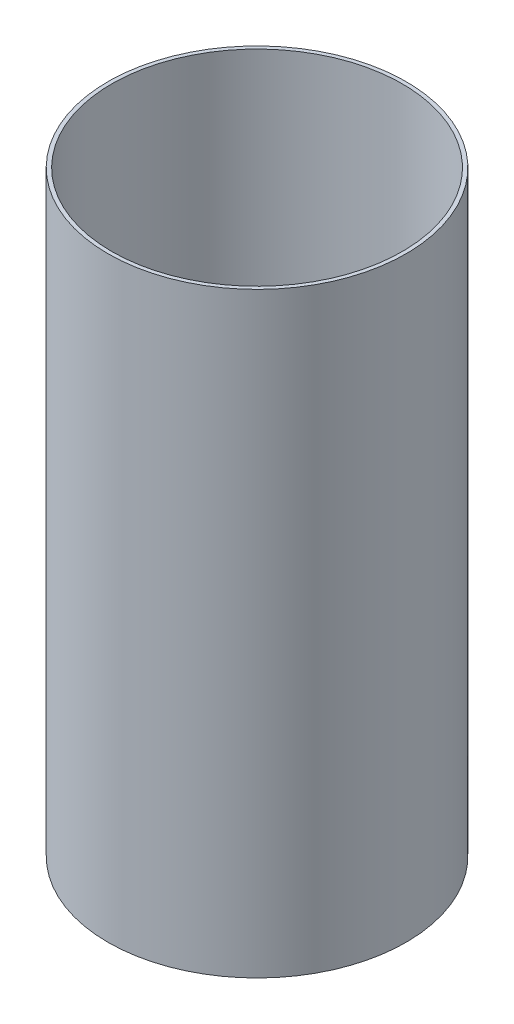
from build123d import *

# Parameters (mm, degrees)
BOSS_EXTRUDE1_DEPTH      = 150
BOSS_EXTRUDE1_DEPTH_BACK = 150
SKETCH1_R                = 75
CUT_EXTRUDE2_DEPTH       = 10
CUT_EXTRUDE2_DEPTH_BACK  = 315
SKETCH2_R                = 73.085452682


with BuildPart() as part:
    # Sketch1 → Boss-Extrude1 (new, two sides: drawn at the far end of the back side and taken through both)
    with BuildSketch(Plane(origin=(0, 0, 0), x_dir=(1, 0, 0), z_dir=(0, 1, 0)).offset(-BOSS_EXTRUDE1_DEPTH_BACK)):
        Circle(SKETCH1_R)
    extrude(amount=BOSS_EXTRUDE1_DEPTH + BOSS_EXTRUDE1_DEPTH_BACK)

    # Sketch2 → Cut-Extrude2 (cut, two sides: drawn at the far end of the back side and taken through both)
    with BuildSketch(Plane(origin=(0, 150, 0), x_dir=(1, 0, 0), z_dir=(0, 1, 0)).offset(-CUT_EXTRUDE2_DEPTH_BACK)):
        Circle(SKETCH2_R)
    extrude(amount=CUT_EXTRUDE2_DEPTH + CUT_EXTRUDE2_DEPTH_BACK, mode=Mode.SUBTRACT)


solid = part.part
